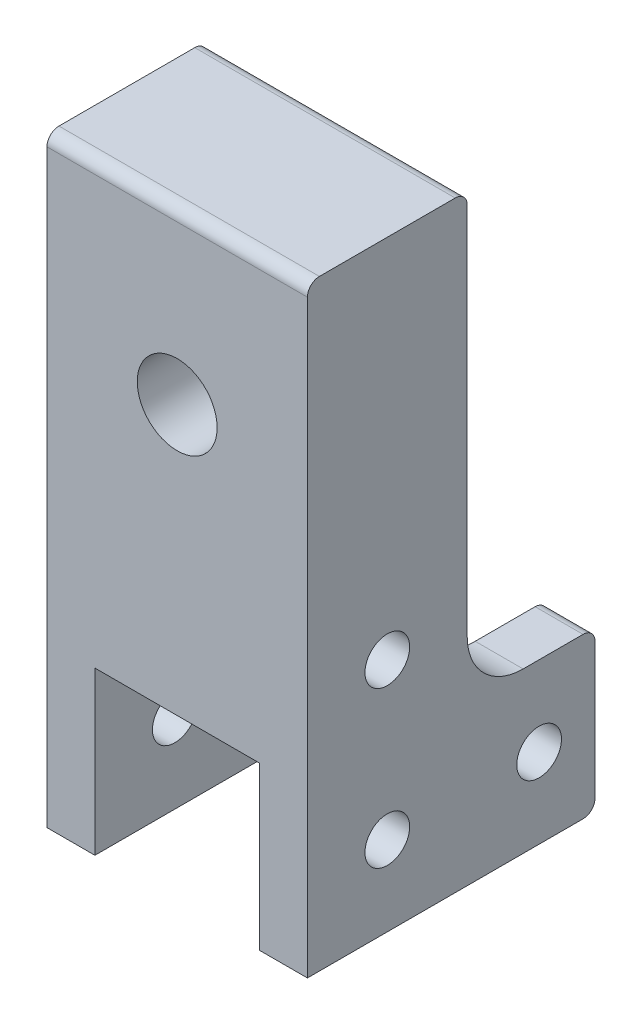
from build123d import *

# Parameters (mm, degrees)
EXTRUDE1_DEPTH      = 10.3
EXTRUDE1_DEPTH_BACK = 10.3
SKETCH1_W           = 20
SKETCH1_H           = 55
EXTRUDE2_DEPTH      = 6
SKETCH4_R           = 2.8
EXTRUDE3_DEPTH      = 78.478061411
SKETCH5_R           = 5
EXTRUDE4_DEPTH      = 77.326797391
FILLET2_R           = 1.5
SKETCH_1_W          = 32.6
SKETCH_1_H          = 73.8
CUT_EXTRUDE_1_DEPTH = 77.326797391


with BuildPart() as part:
    # Sketch1 → Extrude1 (new, two sides: drawn at the far end of the back side and taken through both)
    with BuildSketch(Plane(origin=(0, 0, 0), x_dir=(0, 0, -1), z_dir=(1, 0, 0)).offset(-EXTRUDE1_DEPTH_BACK)):
        with Locations((0, 37.8)):
            Rectangle(SKETCH1_W, SKETCH1_H)
    extrude(amount=EXTRUDE1_DEPTH + EXTRUDE1_DEPTH_BACK)

    # Sketch2 → Extrude2 (add)
    with BuildSketch(Plane(origin=(10.3, 0, 0), x_dir=(0, 0, -1), z_dir=(1, 0, 0))):
        with BuildLine():
            Line((26, 10), (17, 10))
            ThreePointArc((17, 10), (12.050252532, 12.050252532), (10, 17))
            Line((10, 17), (10, 65.3))
            Line((10, 65.3), (-10, 65.3))
            Line((-10, 65.3), (-10, 17))
            ThreePointArc((-10, 17), (-12.050252532, 12.050252532), (-17, 10))
            Line((-17, 10), (-26, 10))
            Line((-26, 10), (-26, -10))
            Line((-26, -10), (26, -10))
            Line((26, -10), (26, 10))
        make_face()
    extrude2 = extrude(amount=EXTRUDE2_DEPTH)

    # Mirror2: Extrude2 across plane
    add(extrude2.mirror(Plane(origin=(0, 0, 0), x_dir=(0, 0, 1), z_dir=(1, 0, 0))))

    # Sketch4 → Extrude3 (cut, through all)
    with BuildSketch(Plane(origin=(16.3, 0, 0), x_dir=(0, 0, -1), z_dir=(1, 0, 0))):
        Circle(SKETCH4_R)
        with Locations((19, 0)):
            Circle(SKETCH4_R)
        with Locations((-19, 0)):
            Circle(SKETCH4_R)
        with Locations((0, 19.5)):
            Circle(SKETCH4_R)
    extrude(amount=-EXTRUDE3_DEPTH, mode=Mode.SUBTRACT)

    # Sketch5 → Extrude4 (cut, through all)
    with BuildSketch(Plane.XY.offset(10)):
        with Locations((0, 44)):
            Circle(SKETCH5_R)
    extrude(amount=-EXTRUDE4_DEPTH, mode=Mode.SUBTRACT)

    # Fillet2
    fillet2_edges = [part.edges().sort_by_distance(p)[0] for p in [
        (13.3, -10, 26),
        (13.3, 10, 26),
        (-13.3, 10, 26),
        (-13.3, -10, 26),
        (-13.3, -10, -26),
        (13.3, -10, -26),
        (13.3, 10, -26),
        (-13.3, 10, -26),
        (0, 65.3, 10),
        (0, 65.3, -10),
    ]]
    fillet(fillet2_edges, radius=FILLET2_R)

    # Эскиз1 → Вырез-Вытянуть1 (cut, through all)
    with BuildSketch(Plane(origin=(0, 0, 10), x_dir=(-1, 0, 0), z_dir=(0, 0, -1))):
        with Locations((0, 26.9)):
            Rectangle(SKETCH_1_W, SKETCH_1_H)
    extrude(amount=-CUT_EXTRUDE_1_DEPTH, mode=Mode.SUBTRACT)


solid = part.part
